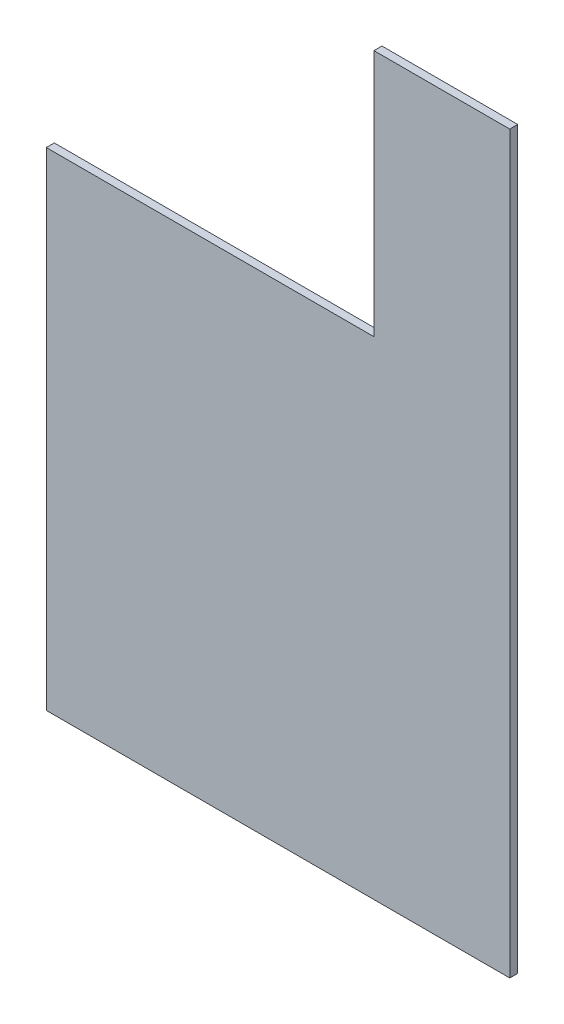
from build123d import *

# Parameters (mm, degrees)
BOSS_EXTRU_1_DEPTH = 2


with BuildPart() as part:
    # Esquisse1 → Boss.-Extru.1 (new body)
    with BuildSketch(Plane.XY):
        Polygon((0, 122), (82, 122), (82, 184), (116, 184), (116, 0), (0, 0), align=None)
    extrude(amount=BOSS_EXTRU_1_DEPTH)


solid = part.part
